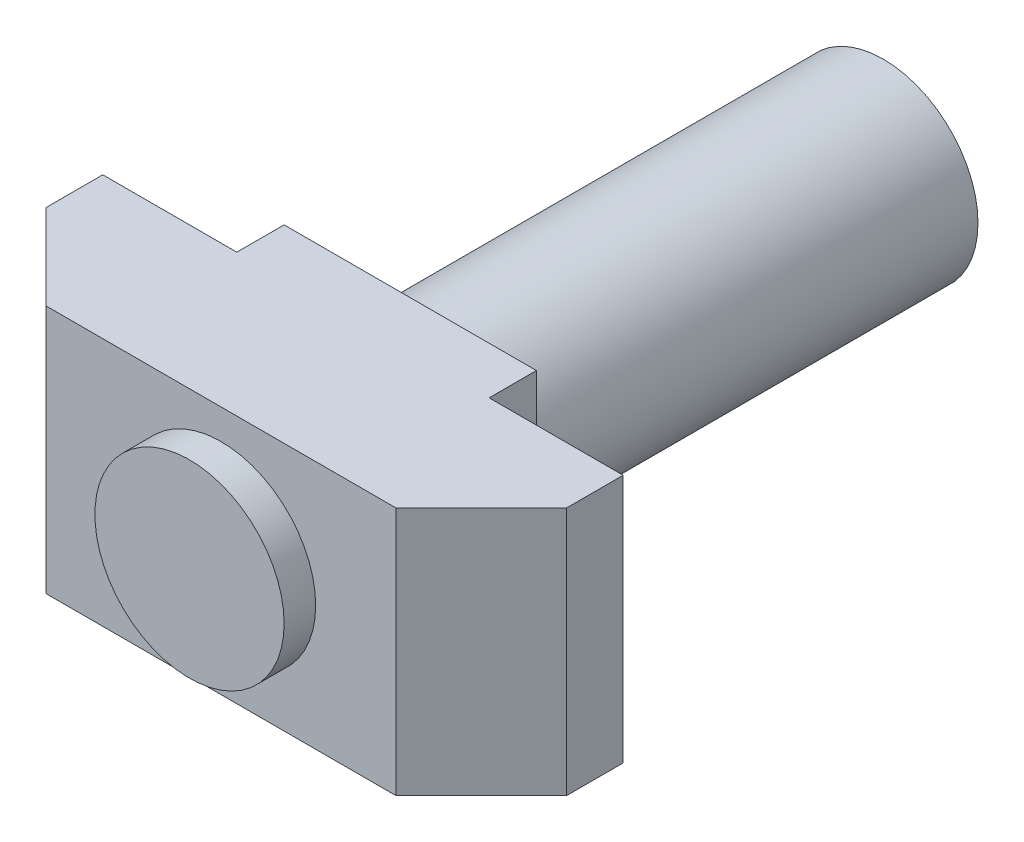
from build123d import *

# Parameters (mm, degrees)
SKETCH1_R           = 3
BOSS_EXTRUDE1_DEPTH = 22
BOSS_EXTRUDE2_DEPTH = 3.95


with BuildPart() as part:
    # Sketch1 → Boss-Extrude1 (new body)
    with BuildSketch(Plane.XY):
        Circle(SKETCH1_R)
    extrude(amount=BOSS_EXTRUDE1_DEPTH)

    # Sketch2 → Boss-Extrude2 (add, symmetric)
    with BuildSketch(Plane(origin=(0, 0, 0), x_dir=(1, 0, 0), z_dir=(0, 1, 0))):
        Polygon((-5.55, -21), (-8.25, -18.3), (-8.25, -16.5), (-4, -16.5), (-4, -15), (4, -15), (4, -16.5), (8.25, -16.5), (8.25, -18.3), (5.55, -21), align=None)
    extrude(amount=BOSS_EXTRUDE2_DEPTH, both=True)


solid = part.part
